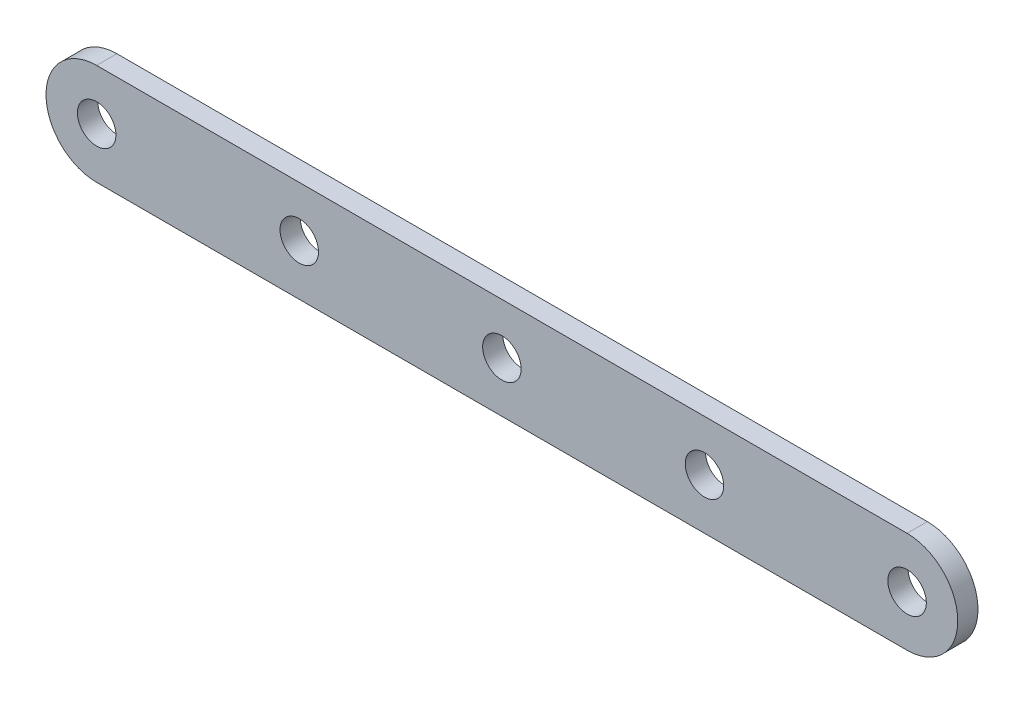
from build123d import *

# Parameters (mm, degrees)
SALIENTE_EXTRUIR1_DEPTH = 1.27
CROQUIS2_R              = 2.413
CORTAR_EXTRUIR1_DEPTH   = 61.969195339
MATRIZL2_COUNT          = 5
MATRIZL2_PITCH          = 25.4


with BuildPart() as part:
    # Croquis1 → Saliente-Extruir1 (new, symmetric)
    with BuildSketch(Plane.XY):
        with BuildLine():
            Line((48.26, -12.161212121), (-53.34, -12.161212121))
            ThreePointArc((-53.34, -12.161212121), (-59.69, -5.811212121), (-53.34, 0.538787879))
            Line((-53.34, 0.538787879), (48.26, 0.538787879))
            ThreePointArc((48.26, 0.538787879), (54.61, -5.811212121), (48.26, -12.161212121))
        make_face()
    extrude(amount=SALIENTE_EXTRUIR1_DEPTH, both=True)

    # Croquis2 → Cortar-Extruir1 (cut, through all)
    with BuildSketch(Plane.XY.offset(1.27)):
        with Locations((-53.34, -5.811212121)):
            Circle(CROQUIS2_R)
    cortar_extruir1 = extrude(amount=-CORTAR_EXTRUIR1_DEPTH, mode=Mode.SUBTRACT)

    # MatrizL2: Cortar-Extruir1 ×5
    with Locations(*[(i * MATRIZL2_PITCH, 0, 0) for i in range(1, MATRIZL2_COUNT)]):
        add(cortar_extruir1, mode=Mode.SUBTRACT)


solid = part.part
